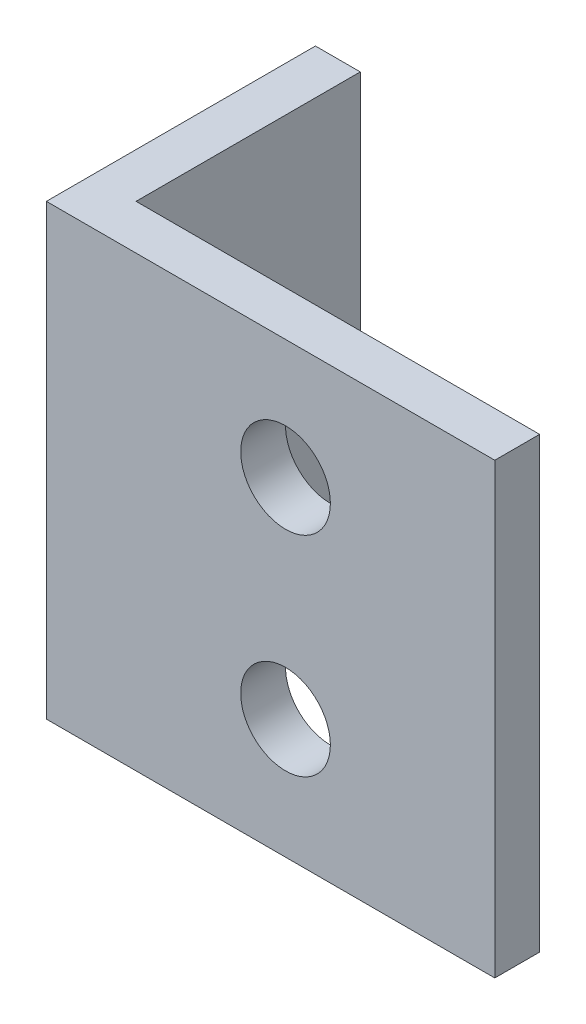
from build123d import *

# Parameters (mm, degrees)
EXTRUSION1_DEPTH = 15
ESQUISSE2_R      = 1.5
EXTRUSION2_DEPTH = 15


with BuildPart() as part:
    # Esquisse1 → Extrusion1 (new body)
    with BuildSketch(Plane(origin=(0, 0, 0), x_dir=(1, 0, 0), z_dir=(0, 1, 0))):
        Polygon((-33.019781622, 0), (-33.019781622, 9), (-31.519781622, 9), (-31.519781622, 1.5), (-18.019781622, 1.5), (-18.019781622, 0), align=None)
    extrude(amount=EXTRUSION1_DEPTH)

    # Esquisse2 → Extrusion2 (cut)
    with BuildSketch(Plane.XY):
        with Locations((-25.019781622, 11)):
            Circle(ESQUISSE2_R)
        with Locations((-25.019781622, 4)):
            Circle(ESQUISSE2_R)
    extrude(amount=-EXTRUSION2_DEPTH, mode=Mode.SUBTRACT)


solid = part.part
